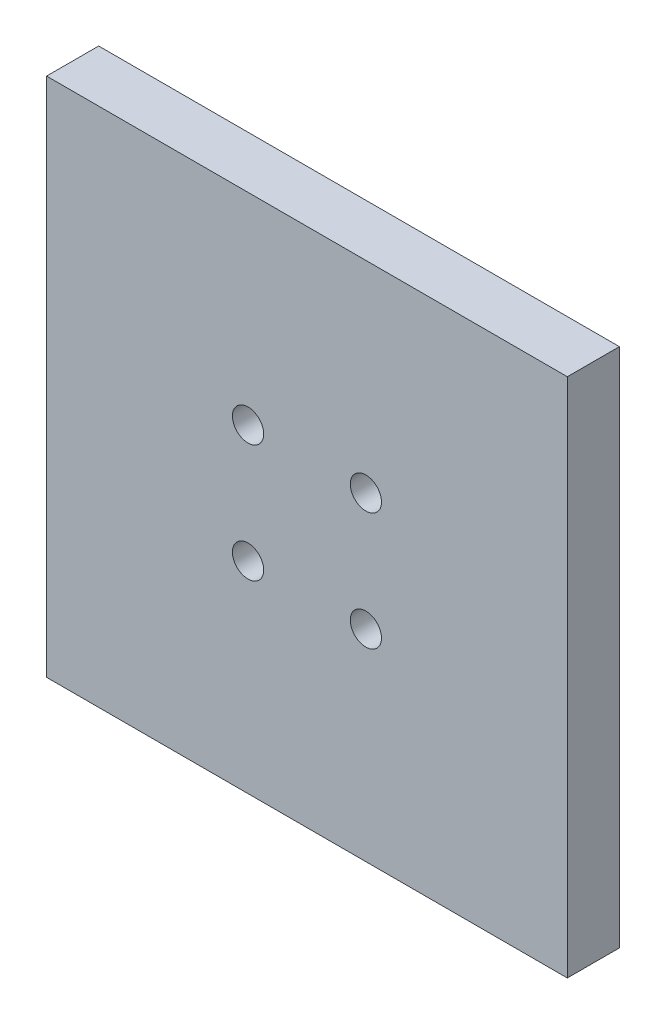
from build123d import *

# Parameters (mm, degrees)
SKETCH1_W           = 50
SKETCH1_H           = 50
BOSS_EXTRUDE1_DEPTH = 5
SKETCH2_R           = 1.5
CUT_EXTRUDE1_DEPTH  = 5


with BuildPart() as part:
    # Sketch1 → Boss-Extrude1 (new body)
    with BuildSketch(Plane.XY):
        Rectangle(SKETCH1_W, SKETCH1_H)
    extrude(amount=BOSS_EXTRUDE1_DEPTH)

    # Sketch2 → Cut-Extrude1 (cut)
    with BuildSketch(Plane.XY.offset(5)):
        with Locations((5.656854249, 5.656854249)):
            Circle(SKETCH2_R)
        with Locations((5.656854249, -5.656854249)):
            Circle(SKETCH2_R)
        with Locations((-5.656854249, -5.656854249)):
            Circle(SKETCH2_R)
        with Locations((-5.656854249, 5.656854249)):
            Circle(SKETCH2_R)
    extrude(amount=-CUT_EXTRUDE1_DEPTH, mode=Mode.SUBTRACT)


solid = part.part
